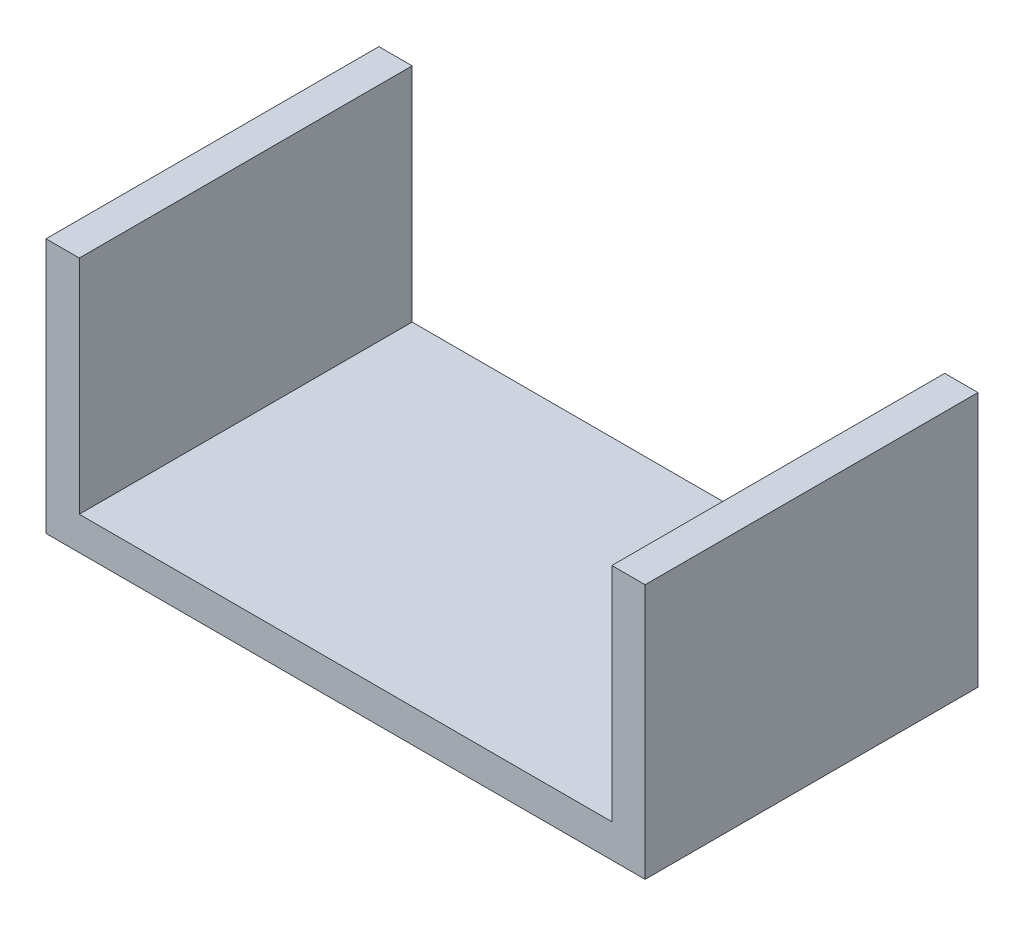
from build123d import *

# Parameters (mm, degrees)
SKETCH1_W           = 54
SKETCH1_H           = 30
BOSS_EXTRUDE1_DEPTH = 3
SKETCH2_W           = 3
SKETCH2_H           = 30
BOSS_EXTRUDE2_DEPTH = 20
SKETCH3_W           = 3
SKETCH3_H           = 30
BOSS_EXTRUDE3_DEPTH = 20


with BuildPart() as part:
    # Sketch1 → Boss-Extrude1 (new body)
    with BuildSketch(Plane(origin=(0, 0, 0), x_dir=(1, 0, 0), z_dir=(0, 1, 0))):
        Rectangle(SKETCH1_W, SKETCH1_H)
    extrude(amount=BOSS_EXTRUDE1_DEPTH)

    # Sketch2 → Boss-Extrude2 (add)
    with BuildSketch(Plane(origin=(0, 3, 0), x_dir=(1, 0, 0), z_dir=(0, 1, 0))):
        with Locations((-25.5, 0)):
            Rectangle(SKETCH2_W, SKETCH2_H)
    extrude(amount=BOSS_EXTRUDE2_DEPTH)

    # Sketch3 → Boss-Extrude3 (add)
    with BuildSketch(Plane(origin=(0, 3, 0), x_dir=(1, 0, 0), z_dir=(0, 1, 0))):
        with Locations((25.5, 0)):
            Rectangle(SKETCH3_W, SKETCH3_H)
    extrude(amount=BOSS_EXTRUDE3_DEPTH)


solid = part.part
